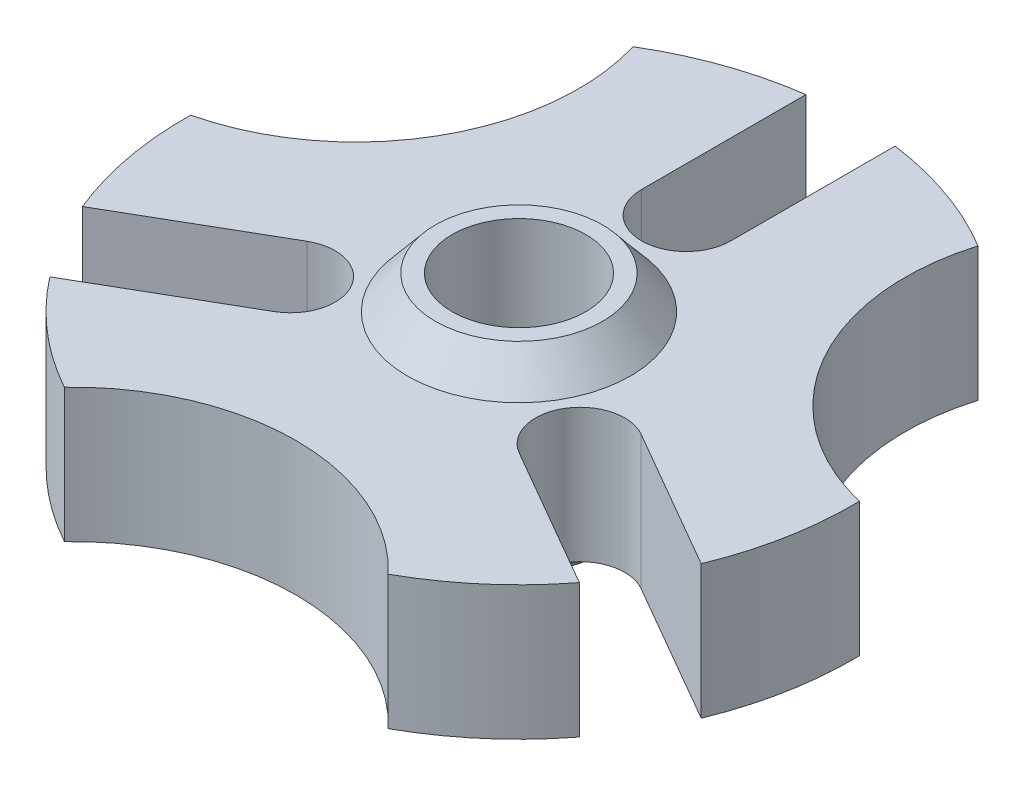
from build123d import *

# Parameters (mm, degrees)
SKETCH_1_R      = 6
EXTRUDE_2_DEPTH = 6


with BuildPart() as part:
    # 草图1 → 凸台-拉伸2 (new, symmetric)
    with BuildSketch(Plane(origin=(0, 0, 0), x_dir=(1, 0, 0), z_dir=(0, 1, 0))):
        with BuildLine():
            Line((-10.990381057, -10.964101615), (-23.748786379, -18.330170362))
            ThreePointArc((-23.748786379, -18.330170362), (-19.541660382, -22.76232654), (-14.523687548, -26.25))
            ThreePointArc((-14.523687548, -26.25), (0, -20), (14.523687548, -26.25))
            ThreePointArc((14.523687548, -26.25), (19.541660382, -22.76232654), (23.748786379, -18.330170362))
            Line((23.748786379, -18.330170362), (10.990381057, -10.964101615))
            ThreePointArc((10.990381057, -10.964101615), (9.526279442, -5.5), (14.990381057, -4.035898385))
            Line((14.990381057, -4.035898385), (27.748786379, -11.401967132))
            ThreePointArc((27.748786379, -11.401967132), (29.483583224, -5.542411054), (29.995010623, 0.547117627))
            ThreePointArc((29.995010623, 0.547117627), (17.320508076, 10), (15.471323075, 25.702882373))
            ThreePointArc((15.471323075, 25.702882373), (9.941922841, 28.304737593), (4, 29.732137495))
            Line((4, 29.732137495), (4, 15))
            ThreePointArc((4, 15), (0, 11), (-4, 15))
            Line((-4, 15), (-4, 29.732137495))
            ThreePointArc((-4, 29.732137495), (-9.941922841, 28.304737593), (-15.471323075, 25.702882373))
            ThreePointArc((-15.471323075, 25.702882373), (-17.320508076, 10), (-29.995010623, 0.547117627))
            ThreePointArc((-29.995010623, 0.547117627), (-29.483583224, -5.542411054), (-27.748786379, -11.401967132))
            Line((-27.748786379, -11.401967132), (-14.990381057, -4.035898385))
            ThreePointArc((-14.990381057, -4.035898385), (-9.526279442, -5.5), (-10.990381057, -10.964101615))
        make_face()
        with Locations(Location((0, 0, 0), (0, 0, 270))):
            Circle(SKETCH_1_R, mode=Mode.SUBTRACT)
    extrude(amount=EXTRUDE_2_DEPTH, both=True)

    # 草图3 → 旋转2 (revolve)
    with BuildSketch(Plane(origin=(0, 0, 0), x_dir=(0, 0, -1), z_dir=(1, 0, 0))):
        Polygon((-10, 6), (-7.5, 9), (-6, 9), (-6, 6), align=None)
    revolve_2 = revolve(axis=Axis((0, 16.131008677, 0), (0, -1, 0)))

    # 镜向2: 旋转2 across plane
    add(revolve_2.mirror(Plane.ZX))


solid = part.part
